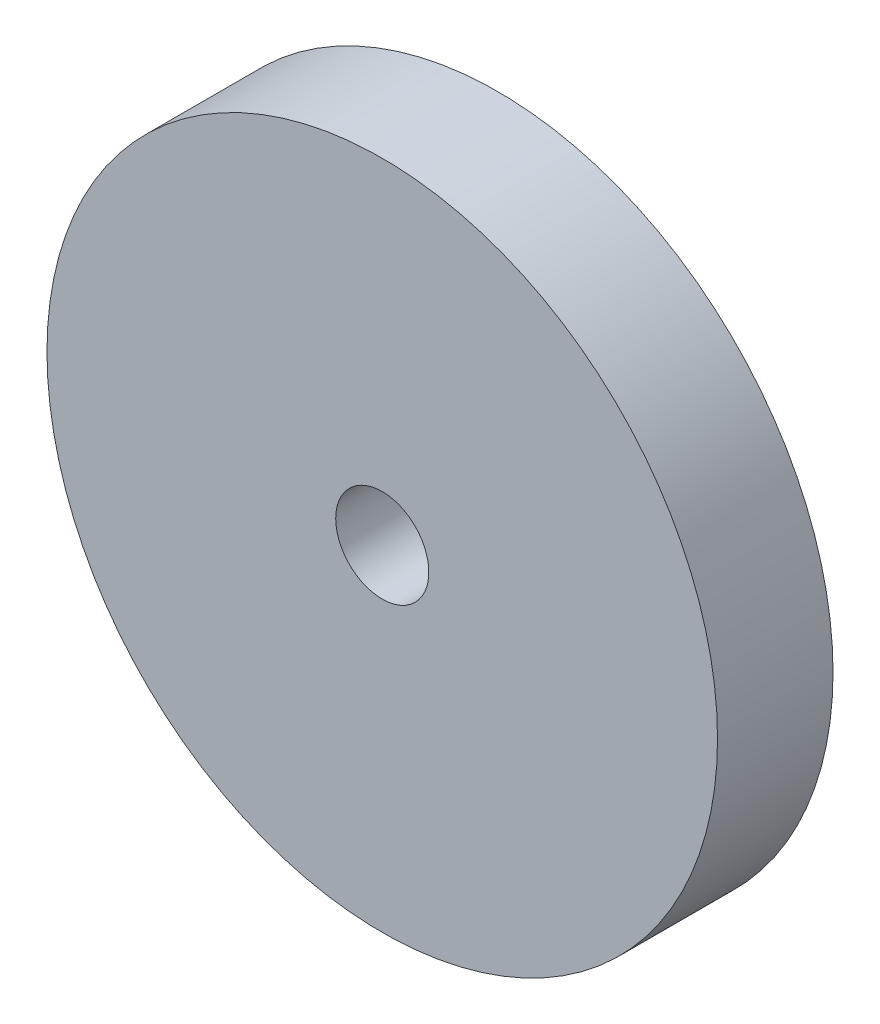
from build123d import *

# Parameters (mm, degrees)
SKETCH1_R           = 18
SKETCH1_R_2         = 2.5
BOSS_EXTRUDE1_DEPTH = 6.2


with BuildPart() as part:
    # Sketch1 → Boss-Extrude1 (new body)
    with BuildSketch(Plane.XY):
        with Locations(Location((0, 0, 0), (0, 0, 180))):
            Circle(SKETCH1_R)
        with Locations(Location((0, 0, 0), (0, 0, 180))):
            Circle(SKETCH1_R_2, mode=Mode.SUBTRACT)
    extrude(amount=BOSS_EXTRUDE1_DEPTH)


solid = part.part
